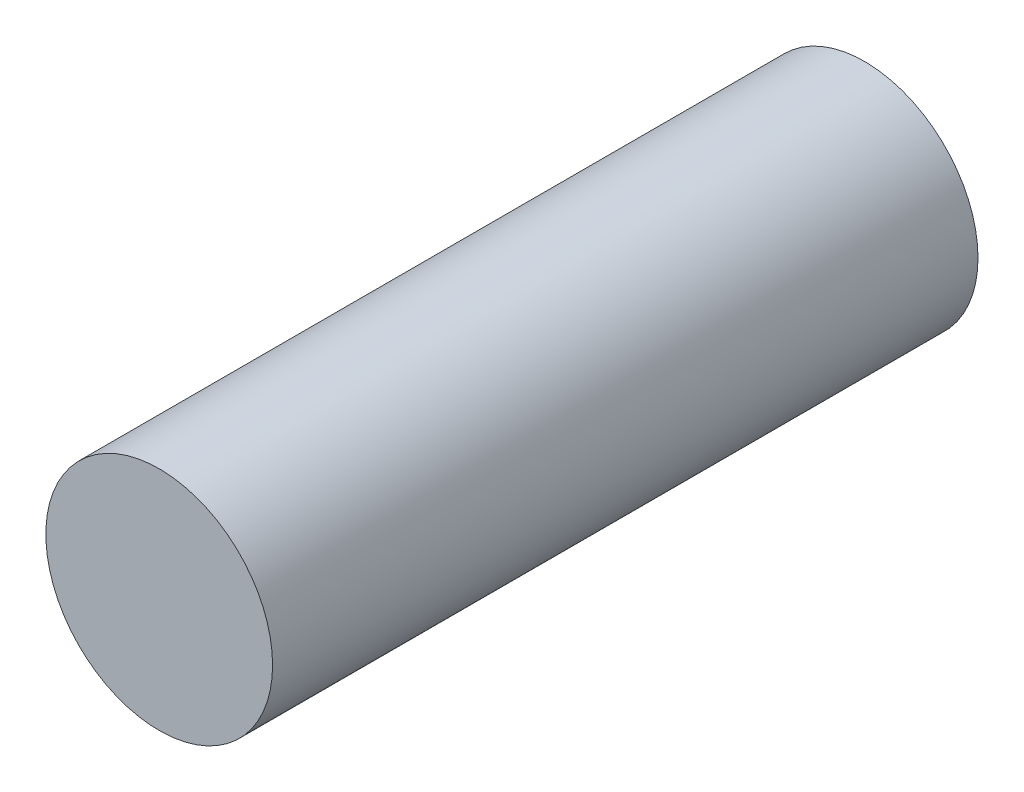
from build123d import *

# Parameters (mm, degrees)
CROQUIS1_R              = 9
SALIENTE_EXTRUIR1_DEPTH = 56


with BuildPart() as part:
    # Croquis1 → Saliente-Extruir1 (new body)
    with BuildSketch(Plane.XY):
        Circle(CROQUIS1_R)
    extrude(amount=SALIENTE_EXTRUIR1_DEPTH)


solid = part.part
